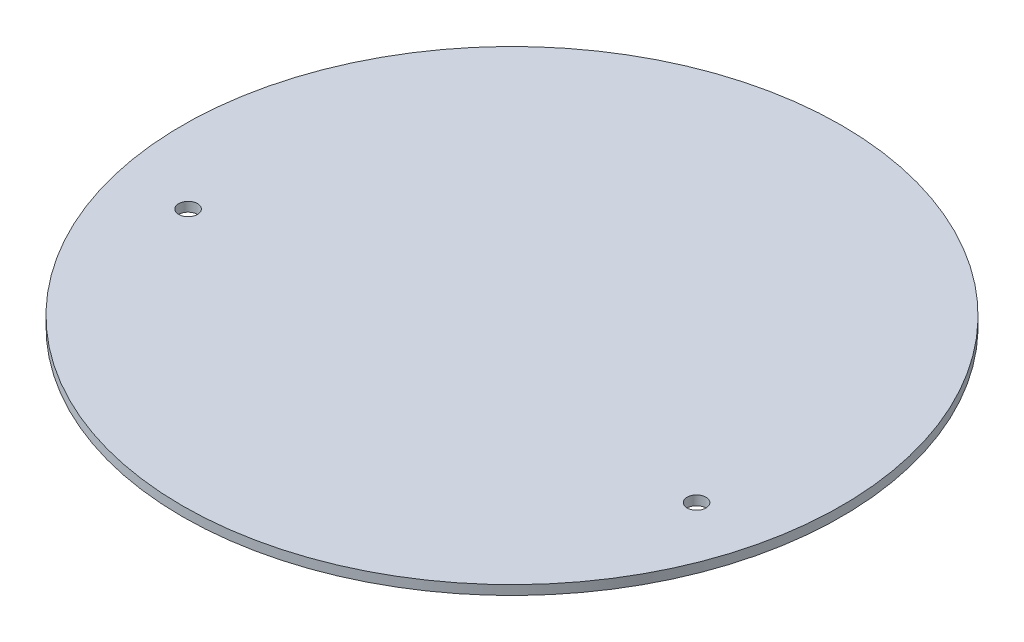
from build123d import *

# Parameters (mm, degrees)
SKETCH1_R           = 35
SKETCH1_R_2         = 1
BOSS_EXTRUDE1_DEPTH = 0.5


with BuildPart() as part:
    # Sketch1 → Boss-Extrude1 (new, symmetric)
    with BuildSketch(Plane(origin=(0, 0, 0), x_dir=(1, 0, 0), z_dir=(0, 1, 0))):
        with Locations(Location((0, 0, 0), (0, 0, 270))):
            Circle(SKETCH1_R)
        with Locations(Location((-27, -7.4, 0), (0, 0, 270))):
            Circle(SKETCH1_R_2, mode=Mode.SUBTRACT)
        with Locations(Location((27, -7.4, 0), (0, 0, 270))):
            Circle(SKETCH1_R_2, mode=Mode.SUBTRACT)
    extrude(amount=BOSS_EXTRUDE1_DEPTH, both=True)


solid = part.part
